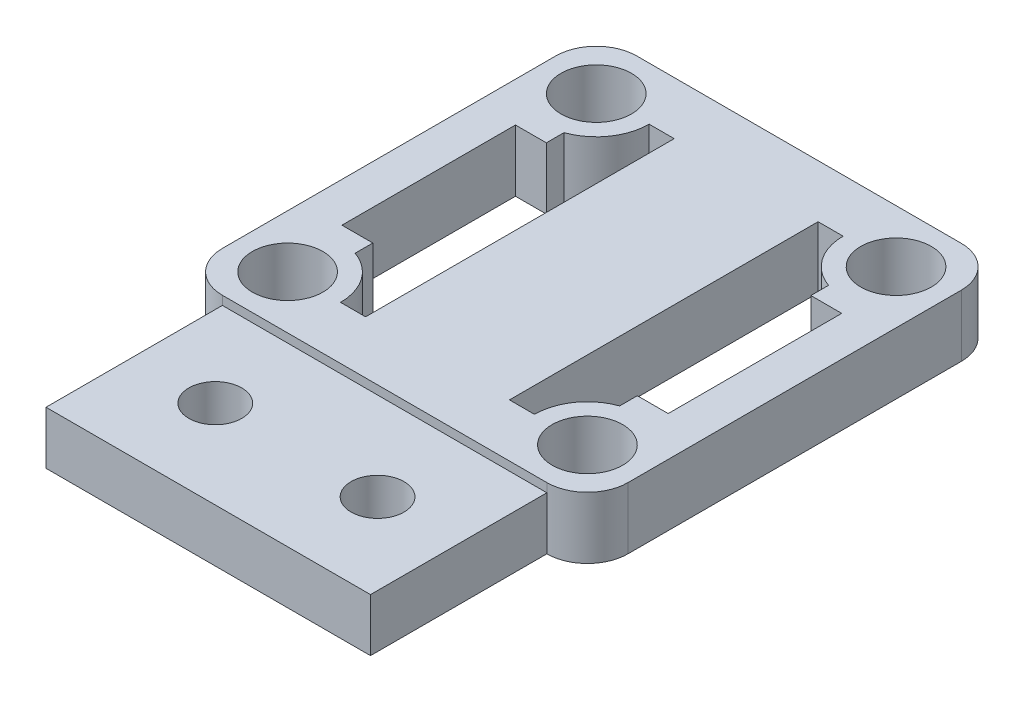
from build123d import *

# Parameters (mm, degrees)
BOSS_EXTRUDE1_DEPTH      = 2
CUT_EXTRUDE2_DEPTH       = 1
SKETCH5_R                = 2
CUT_EXTRUDE3_DEPTH       = 21.942838525
CUT_EXTRUDE4_DEPTH       = 21.942838525
SKETCH7_W                = 18.4
SKETCH7_H                = 1
BOSS_EXTRUDE2_DEPTH      = 10
SKETCH8_R                = 1.5
CUT_EXTRUDE5_DEPTH       = 25.092211634
CUT_EXTRUDE6_DEPTH       = 1
SKETCH11_W               = 1.421057218
SKETCH11_H               = 17.5
SKETCH11_W_2             = 1.75
SKETCH11_H_2             = 9.84
CUT_EXTRUDE7_DEPTH       = 25.092211634
BOSS_EXTRUDE3_START      = 2
BOSS_EXTRUDE3_DEPTH      = 2
CUT_EXTRUDE8_DEPTH       = 25.154392176
CUT_EXTRUDE8_DEPTH_BACK  = 25.154392176
CUT_EXTRUDE9_DEPTH       = 25.154392176
CUT_EXTRUDE9_DEPTH_BACK  = 25.154392176
CUT_EXTRUDE10_DEPTH      = 25.154392176
CUT_EXTRUDE10_DEPTH_BACK = 25.154392176
SKETCH15_R               = 1.5
CUT_EXTRUDE11_DEPTH      = 25.154392176
CUT_EXTRUDE11_DEPTH_BACK = 25.154392176
SKETCH16_R               = 1.5
CUT_EXTRUDE12_DEPTH      = 25.154392176
CUT_EXTRUDE12_DEPTH_BACK = 25.154392176
SKETCH17_R               = 2
BOSS_EXTRUDE4_START      = 1
BOSS_EXTRUDE4_DEPTH      = 1
CUT_EXTRUDE13_DEPTH      = 25.257672217
CUT_EXTRUDE13_DEPTH_BACK = 25.257672217
SKETCH19_R               = 2
CUT_EXTRUDE14_START      = -0.5
CUT_EXTRUDE14_DEPTH      = 0.5


with BuildPart() as part:
    # Sketch1 → Boss-Extrude1 (new body)
    with BuildSketch(Plane(origin=(0, 0, 0), x_dir=(1, 0, 0), z_dir=(0, 1, 0))):
        with BuildLine():
            Line((-12.649074074, 14.633101852), (5.750925926, 14.633101852))
            ThreePointArc((5.750925926, 14.633101852), (7.377271523, 13.959447449), (8.050925926, 12.333101852))
            Line((8.050925926, 12.333101852), (8.050925926, -6.566898148))
            ThreePointArc((8.050925926, -6.566898148), (7.377271523, -8.193243745), (5.750925926, -8.866898148))
            Line((5.750925926, -8.866898148), (-12.649074074, -8.866898148))
            ThreePointArc((-12.649074074, -8.866898148), (-14.275419671, -8.193243745), (-14.949074074, -6.566898148))
            Line((-14.949074074, -6.566898148), (-14.949074074, 12.333101852))
            ThreePointArc((-14.949074074, 12.333101852), (-14.275419671, 13.959447449), (-12.649074074, 14.633101852))
        make_face()
    extrude(amount=BOSS_EXTRUDE1_DEPTH)

    # Sketch2 → Cut-Extrude2 (cut)
    with BuildSketch(Plane(origin=(0, 2, 0), x_dir=(1, 0, 0), z_dir=(0, 1, 0))):
        with BuildLine():
            Line((5.750925926, 13.633101852), (-12.649074074, 13.633101852))
            ThreePointArc((-12.649074074, 13.633101852), (-13.56831289, 13.252340667), (-13.949074074, 12.333101852))
            Line((-13.949074074, 12.333101852), (-13.949074074, -6.566898148))
            ThreePointArc((-13.949074074, -6.566898148), (-13.56831289, -7.486136964), (-12.649074074, -7.866898148))
            Line((-12.649074074, -7.866898148), (5.750925926, -7.866898148))
            ThreePointArc((5.750925926, -7.866898148), (6.670164741, -7.486136964), (7.050925926, -6.566898148))
            Line((7.050925926, -6.566898148), (7.050925926, 12.333101852))
            ThreePointArc((7.050925926, 12.333101852), (6.670164741, 13.252340667), (5.750925926, 13.633101852))
        make_face()
    extrude(amount=-CUT_EXTRUDE2_DEPTH, mode=Mode.SUBTRACT)

    # Sketch5 → Cut-Extrude3 (cut, through all)
    with BuildSketch(Plane(origin=(0, 1, 0), x_dir=(1, 0, 0), z_dir=(0, 1, 0))):
        with Locations(Location((5.050925926, 11.633101852, 0), (0, 0, 270))):
            Circle(SKETCH5_R)
        with Locations(Location((5.050925926, -5.866898148, 0), (0, 0, 270))):
            Circle(SKETCH5_R)
        with Locations(Location((-11.949074074, -5.866898148, 0), (0, 0, 270))):
            Circle(SKETCH5_R)
        with Locations(Location((-11.949074074, 11.633101852, 0), (0, 0, 90))):
            Circle(SKETCH5_R)
    extrude(amount=-CUT_EXTRUDE3_DEPTH, mode=Mode.SUBTRACT)

    # Sketch6 → Cut-Extrude4 (cut, through all)
    with BuildSketch(Plane(origin=(0, 1, 0), x_dir=(1, 0, 0), z_dir=(0, 1, 0))):
        with BuildLine():
            Line((4.050925926, -3.038471023), (4.050925926, 8.804674727))
            ThreePointArc((4.050925926, 8.804674727), (2.601436183, 9.901051044), (2.050925926, 11.633101852))
            Line((2.050925926, 11.633101852), (2.050925926, -5.866898148))
            ThreePointArc((2.050925926, -5.866898148), (2.601436183, -4.134847341), (4.050925926, -3.038471023))
        make_face()
        with BuildLine():
            Line((-10.949074074, 8.804674727), (-10.949074074, -3.038471023))
            ThreePointArc((-10.949074074, -3.038471023), (-9.499584331, -4.134847341), (-8.949074074, -5.866898148))
            Line((-8.949074074, -5.866898148), (-8.949074074, 11.633101852))
            ThreePointArc((-8.949074074, 11.633101852), (-9.499584331, 9.901051044), (-10.949074074, 8.804674727))
        make_face()
    extrude(amount=-CUT_EXTRUDE4_DEPTH, mode=Mode.SUBTRACT)

    # Sketch7 → Boss-Extrude2 (add)
    with BuildSketch(Plane.XY.offset(8.866898148)):
        with Locations((-3.449074074, 0.5)):
            Rectangle(SKETCH7_W, SKETCH7_H)
    extrude(amount=BOSS_EXTRUDE2_DEPTH)

    # Sketch8 → Cut-Extrude5 (cut, through all)
    with BuildSketch(Plane(origin=(0, 1, 0), x_dir=(1, 0, 0), z_dir=(0, 1, 0))):
        with Locations(Location((1.150925926, -13.866898148, 0), (0, 0, 270))):
            Circle(SKETCH8_R)
        with Locations(Location((-8.049074074, -13.866898148, 0), (0, 0, 270))):
            Circle(SKETCH8_R)
    extrude(amount=-CUT_EXTRUDE5_DEPTH, mode=Mode.SUBTRACT)

    # Sketch9 → Cut-Extrude6 (cut)
    with BuildSketch(Plane(origin=(0, 2, 0), x_dir=(1, 0, 0), z_dir=(0, 1, 0))):
        with BuildLine():
            Line((5.750925926, 13.833101852), (-12.649074074, 13.833101852))
            ThreePointArc((-12.649074074, 13.833101852), (-13.709734246, 13.393762024), (-14.149074074, 12.333101852))
            Line((-14.149074074, 12.333101852), (-14.149074074, -6.566898148))
            ThreePointArc((-14.149074074, -6.566898148), (-13.709734246, -7.62755832), (-12.649074074, -8.066898148))
            Line((-12.649074074, -8.066898148), (5.750925926, -8.066898148))
            ThreePointArc((5.750925926, -8.066898148), (6.811586098, -7.62755832), (7.250925926, -6.566898148))
            Line((7.250925926, -6.566898148), (7.250925926, 12.333101852))
            ThreePointArc((7.250925926, 12.333101852), (6.811586098, 13.393762024), (5.750925926, 13.833101852))
        make_face()
    extrude(amount=-CUT_EXTRUDE6_DEPTH, mode=Mode.SUBTRACT)

    # Sketch11 → Cut-Extrude7 (cut, through all)
    with BuildSketch(Plane(origin=(0, 1, 0), x_dir=(1, 0, 0), z_dir=(0, 1, 0))):
        with Locations((-8.238545465, 2.883101852)):
            Rectangle(SKETCH11_W, SKETCH11_H)
        with Locations((1.340397317, 2.883101852)):
            Rectangle(SKETCH11_W, SKETCH11_H)
        with Locations((-11.824074074, 2.883101852)):
            Rectangle(SKETCH11_W_2, SKETCH11_H_2)
        with Locations((4.925925926, 2.883101852)):
            Rectangle(SKETCH11_W_2, SKETCH11_H_2)
    extrude(amount=-CUT_EXTRUDE7_DEPTH, mode=Mode.SUBTRACT)

    # Sketch12 → Boss-Extrude3 (add)
    with BuildSketch(Plane.XZ.offset(BOSS_EXTRUDE3_START)):
        with BuildLine():
            Line((8.050925926, -12.333101852), (8.050925926, 6.566898148))
            ThreePointArc((8.050925926, 6.566898148), (7.377271523, 8.193243745), (5.750925926, 8.866898148))
            Line((5.750925926, 8.866898148), (5.750925926, 18.866898148))
            Line((5.750925926, 18.866898148), (-12.649074074, 18.866898148))
            Line((-12.649074074, 18.866898148), (-12.649074074, 8.866898148))
            ThreePointArc((-12.649074074, 8.866898148), (-14.275419671, 8.193243745), (-14.949074074, 6.566898148))
            Line((-14.949074074, 6.566898148), (-14.949074074, -12.333101852))
            ThreePointArc((-14.949074074, -12.333101852), (-14.275419671, -13.959447449), (-12.649074074, -14.633101852))
            Line((-12.649074074, -14.633101852), (5.750925926, -14.633101852))
            ThreePointArc((5.750925926, -14.633101852), (7.377271523, -13.959447449), (8.050925926, -12.333101852))
        make_face()
    extrude(amount=-BOSS_EXTRUDE3_DEPTH)

    # Sketch13 → Cut-Extrude8 (cut, two sides: drawn at the far end of the back side and taken through both)
    with BuildSketch(Plane(origin=(0, 0, 0), x_dir=(1, 0, 0), z_dir=(0, 1, 0)).offset(-CUT_EXTRUDE8_DEPTH_BACK)):
        with BuildLine():
            Line((-12.699074074, 7.803101852), (-12.699074074, -2.036898148))
            Line((-12.699074074, -2.036898148), (-10.949074074, -2.036898148))
            Line((-10.949074074, -2.036898148), (-10.949074074, -3.038471023))
            ThreePointArc((-10.949074074, -3.038471023), (-9.499584331, -4.134847341), (-8.949074074, -5.866898148))
            Line((-8.949074074, -5.866898148), (-7.528016856, -5.866898148))
            Line((-7.528016856, -5.866898148), (-7.528016856, 11.633101852))
            Line((-7.528016856, 11.633101852), (-8.949074074, 11.633101852))
            ThreePointArc((-8.949074074, 11.633101852), (-9.499584331, 9.901051044), (-10.949074074, 8.804674727))
            Line((-10.949074074, 8.804674727), (-10.949074074, 7.803101852))
            Line((-10.949074074, 7.803101852), (-12.699074074, 7.803101852))
        make_face()
    extrude(amount=CUT_EXTRUDE8_DEPTH + CUT_EXTRUDE8_DEPTH_BACK, mode=Mode.SUBTRACT)

    # Sketch14 → Cut-Extrude9 (cut, two sides: drawn at the far end of the back side and taken through both)
    with BuildSketch(Plane(origin=(0, 0, 0), x_dir=(1, 0, 0), z_dir=(0, 1, 0)).offset(-CUT_EXTRUDE9_DEPTH_BACK)):
        with BuildLine():
            Line((0.629868708, -5.866898148), (2.050925926, -5.866898148))
            ThreePointArc((2.050925926, -5.866898148), (2.601436183, -4.134847341), (4.050925926, -3.038471023))
            Line((4.050925926, -3.038471023), (4.050925926, -2.036898148))
            Line((4.050925926, -2.036898148), (5.800925926, -2.036898148))
            Line((5.800925926, -2.036898148), (5.800925926, 7.803101852))
            Line((5.800925926, 7.803101852), (4.050925926, 7.803101852))
            Line((4.050925926, 7.803101852), (4.050925926, 8.804674727))
            ThreePointArc((4.050925926, 8.804674727), (2.601436183, 9.901051044), (2.050925926, 11.633101852))
            Line((2.050925926, 11.633101852), (0.629868708, 11.633101852))
            Line((0.629868708, 11.633101852), (0.629868708, -5.866898148))
        make_face()
    extrude(amount=CUT_EXTRUDE9_DEPTH + CUT_EXTRUDE9_DEPTH_BACK, mode=Mode.SUBTRACT)

    # Sketch15 → Cut-Extrude10 (cut, two sides: drawn at the far end of the back side and taken through both)
    with BuildSketch(Plane(origin=(0, 0, 0), x_dir=(1, 0, 0), z_dir=(0, 1, 0)).offset(-CUT_EXTRUDE10_DEPTH_BACK)):
        with Locations(Location((-8.049074074, -13.866898148, 0), (0, 0, 270))):
            Circle(SKETCH15_R)
    extrude(amount=CUT_EXTRUDE10_DEPTH + CUT_EXTRUDE10_DEPTH_BACK, mode=Mode.SUBTRACT)

    # Sketch16 → Cut-Extrude11 (cut, two sides: drawn at the far end of the back side and taken through both)
    with BuildSketch(Plane(origin=(0, 0, 0), x_dir=(1, 0, 0), z_dir=(0, 1, 0)).offset(-CUT_EXTRUDE11_DEPTH_BACK)):
        with Locations(Location((1.150925926, -13.866898148, 0), (0, 0, 270))):
            Circle(SKETCH16_R)
    extrude(amount=CUT_EXTRUDE11_DEPTH + CUT_EXTRUDE11_DEPTH_BACK, mode=Mode.SUBTRACT)

    # Sketch17 → Cut-Extrude12 (cut, two sides: drawn at the far end of the back side and taken through both)
    with BuildSketch(Plane(origin=(0, 0, 0), x_dir=(1, 0, 0), z_dir=(0, 1, 0)).offset(-CUT_EXTRUDE12_DEPTH_BACK)):
        with Locations(Location((-11.949074074, -5.866898148, 0), (0, 0, 270))):
            Circle(SKETCH17_R)
        with Locations(Location((5.050925926, -5.866898148, 0), (0, 0, 270))):
            Circle(SKETCH17_R)
        with Locations(Location((-11.949074074, 11.633101852, 0), (0, 0, 270))):
            Circle(SKETCH17_R)
        with Locations(Location((5.050925926, 11.633101852, 0), (0, 0, 270))):
            Circle(SKETCH17_R)
    extrude(amount=CUT_EXTRUDE12_DEPTH + CUT_EXTRUDE12_DEPTH_BACK, mode=Mode.SUBTRACT)

    # Sketch18 → Boss-Extrude4 (add)
    with BuildSketch(Plane(origin=(0, 1, 0), x_dir=(1, 0, 0), z_dir=(0, 1, 0)).offset(BOSS_EXTRUDE4_START)):
        with BuildLine():
            Line((5.750925926, 13.833101852), (-12.649074074, 13.833101852))
            ThreePointArc((-12.649074074, 13.833101852), (-13.709734246, 13.393762024), (-14.149074074, 12.333101852))
            Line((-14.149074074, 12.333101852), (-14.149074074, -6.566898148))
            ThreePointArc((-14.149074074, -6.566898148), (-13.709734246, -7.62755832), (-12.649074074, -8.066898148))
            Line((-12.649074074, -8.066898148), (5.750925926, -8.066898148))
            ThreePointArc((5.750925926, -8.066898148), (6.811586098, -7.62755832), (7.250925926, -6.566898148))
            Line((7.250925926, -6.566898148), (7.250925926, 12.333101852))
            ThreePointArc((7.250925926, 12.333101852), (6.811586098, 13.393762024), (5.750925926, 13.833101852))
        make_face()
    extrude(amount=-BOSS_EXTRUDE4_DEPTH)

    # Sketch19 → Cut-Extrude13 (cut, two sides: drawn at the far end of the back side and taken through both)
    with BuildSketch(Plane.XZ.offset(-1).offset(-CUT_EXTRUDE13_DEPTH_BACK)):
        with Locations(Location((5.050925926, -11.633101852, 0), (0, 0, 90))):
            Circle(SKETCH19_R)
        with Locations(Location((-11.949074074, -11.633101852, 0), (0, 0, 90))):
            Circle(SKETCH19_R)
        with Locations(Location((-11.949074074, 5.866898148, 0), (0, 0, 90))):
            Circle(SKETCH19_R)
        with Locations(Location((5.050925926, 5.866898148, 0), (0, 0, 90))):
            Circle(SKETCH19_R)
        with BuildLine():
            Line((-10.949074074, 3.038471023), (-10.949074074, 2.036898148))
            Line((-10.949074074, 2.036898148), (-12.699074074, 2.036898148))
            Line((-12.699074074, 2.036898148), (-12.699074074, -7.803101852))
            Line((-12.699074074, -7.803101852), (-10.949074074, -7.803101852))
            Line((-10.949074074, -7.803101852), (-10.949074074, -8.804674727))
            ThreePointArc((-10.949074074, -8.804674727), (-9.499584331, -9.901051044), (-8.949074074, -11.633101852))
            Line((-8.949074074, -11.633101852), (-7.528016856, -11.633101852))
            Line((-7.528016856, -11.633101852), (-7.528016856, 5.866898148))
            Line((-7.528016856, 5.866898148), (-8.949074074, 5.866898148))
            ThreePointArc((-8.949074074, 5.866898148), (-9.499584331, 4.134847341), (-10.949074074, 3.038471023))
        make_face()
        with BuildLine():
            Line((4.050925926, 2.036898148), (4.050925926, 3.038471023))
            ThreePointArc((4.050925926, 3.038471023), (2.601436183, 4.134847341), (2.050925926, 5.866898148))
            Line((2.050925926, 5.866898148), (0.629868708, 5.866898148))
            Line((0.629868708, 5.866898148), (0.629868708, -11.633101852))
            Line((0.629868708, -11.633101852), (2.050925926, -11.633101852))
            ThreePointArc((2.050925926, -11.633101852), (2.601436183, -9.901051044), (4.050925926, -8.804674727))
            Line((4.050925926, -8.804674727), (4.050925926, -7.803101852))
            Line((4.050925926, -7.803101852), (5.800925926, -7.803101852))
            Line((5.800925926, -7.803101852), (5.800925926, 2.036898148))
            Line((5.800925926, 2.036898148), (4.050925926, 2.036898148))
        make_face()
    extrude(amount=CUT_EXTRUDE13_DEPTH + CUT_EXTRUDE13_DEPTH_BACK, mode=Mode.SUBTRACT)

    # Sketch20 → Cut-Extrude14 (cut)
    with BuildSketch(Plane(origin=(0, 2, 0), x_dir=(1, 0, 0), z_dir=(0, 1, 0)).offset(CUT_EXTRUDE14_START)):
        with BuildLine():
            Line((5.750925926, 14.633101852), (-12.649074074, 14.633101852))
            ThreePointArc((-12.649074074, 14.633101852), (-14.275419671, 13.959447449), (-14.949074074, 12.333101852))
            Line((-14.949074074, 12.333101852), (-14.949074074, -6.566898148))
            ThreePointArc((-14.949074074, -6.566898148), (-14.275419671, -8.193243745), (-12.649074074, -8.866898148))
            Line((-12.649074074, -8.866898148), (5.750925926, -8.866898148))
            ThreePointArc((5.750925926, -8.866898148), (7.377271523, -8.193243745), (8.050925926, -6.566898148))
            Line((8.050925926, -6.566898148), (8.050925926, 12.333101852))
            ThreePointArc((8.050925926, 12.333101852), (7.377271523, 13.959447449), (5.750925926, 14.633101852))
        make_face()
    extrude(amount=CUT_EXTRUDE14_DEPTH, mode=Mode.SUBTRACT)


solid = part.part
